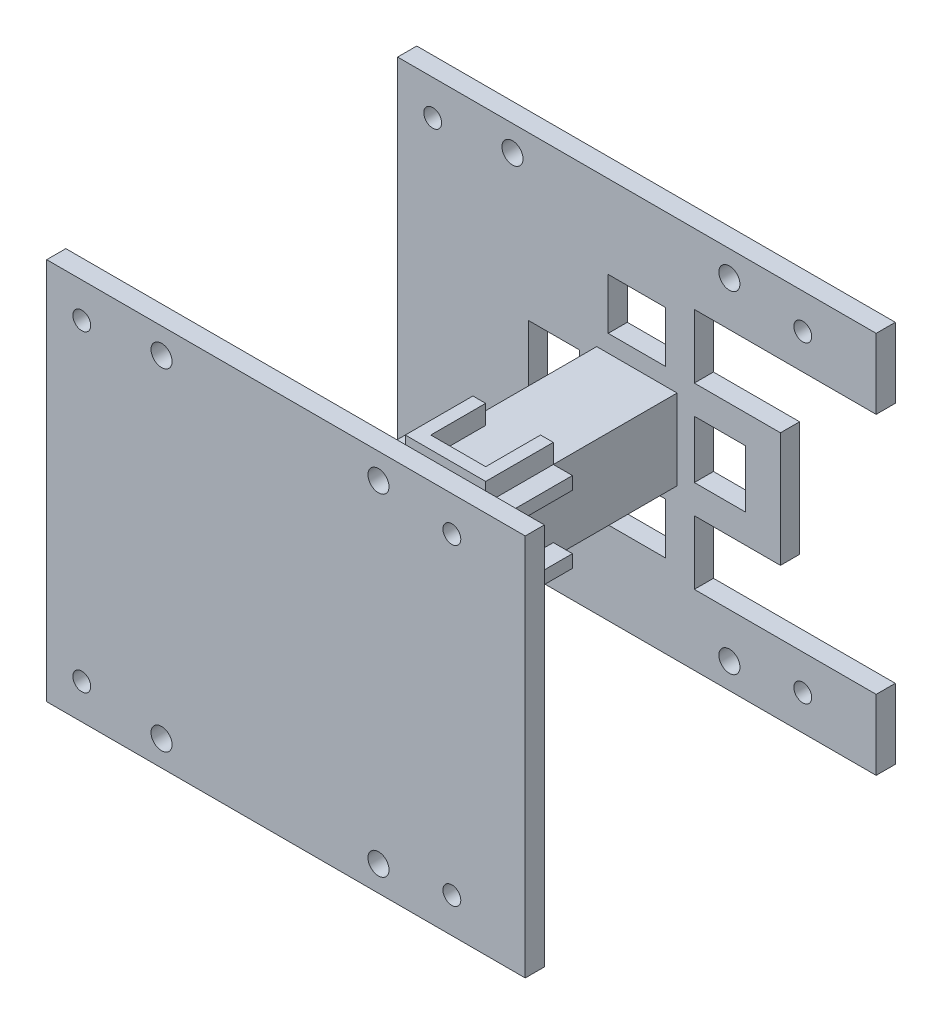
from build123d import *

# Parameters (mm, degrees)
SKETCH_4_R          = 1.4
SKETCH_4_R_2        = 1.65
EXTRUDE_1_DEPTH     = 3
SKETCH_5_W          = 12.6
SKETCH_5_H          = 12.6
EXTRUDE_2_DEPTH     = 30
SKETCH_6_W          = 9
SKETCH_6_H          = 8
SKETCH_6_W_2        = 8
SKETCH_6_H_2        = 9
CUT_EXTRUDE_2_DEPTH = 71.809603868
EXTRUDE_3_DEPTH     = 3
EXTRUDE_4_DEPTH     = 3
EXTRUDE_5_DEPTH     = 3
EXTRUDE_6_DEPTH     = 3
SKETCH_13_W         = 12.6
SKETCH_13_H         = 12.6
EXTRUDE_7_DEPTH     = 22
SKETCH_14_R         = 1.4
SKETCH_14_R_2       = 1.65
EXTRUDE_8_DEPTH     = 3
SKETCH_15_W         = 13.5
SKETCH_15_H         = 10
CUT_EXTRUDE_3_DEPTH = 84.366660003


with BuildPart() as part:
    # 草图4 → 凸台-拉伸1 (new body)
    with BuildSketch(Plane.XY):
        Polygon((-39, 30), (20, 30), (20, 19), (5, 19), (5, -19), (20, -19), (20, -30), (-39, -30), (-55, -30), (-55, 30), align=None)
        with Locations((-49.5, 24.5)):
            Circle(SKETCH_4_R, mode=Mode.SUBTRACT)
        with Locations((8.5, 24.5)):
            Circle(SKETCH_4_R, mode=Mode.SUBTRACT)
        with Locations((-3, 26)):
            Circle(SKETCH_4_R_2, mode=Mode.SUBTRACT)
        with Locations((-37, 26)):
            Circle(SKETCH_4_R_2, mode=Mode.SUBTRACT)
        with Locations(Location((-37, -26, 0), (0, 0, 180))):
            Circle(SKETCH_4_R_2, mode=Mode.SUBTRACT)
        with Locations(Location((-3, -26, 0), (0, 0, 180))):
            Circle(SKETCH_4_R_2, mode=Mode.SUBTRACT)
        with Locations(Location((8.5, -24.5, 0), (0, 0, 180))):
            Circle(SKETCH_4_R, mode=Mode.SUBTRACT)
        with Locations(Location((-49.5, -24.5, 0), (0, 0, 180))):
            Circle(SKETCH_4_R, mode=Mode.SUBTRACT)
    extrude(amount=EXTRUDE_1_DEPTH)

    # 草图5 → 凸台-拉伸2 (add)
    with BuildSketch(Plane.XY.offset(3)):
        with Locations((-17.5, 0)):
            Rectangle(SKETCH_5_W, SKETCH_5_H)
    extrude(amount=EXTRUDE_2_DEPTH)

    # 草图6 → 切除-拉伸2 (cut, through all)
    with BuildSketch(Plane(origin=(0, 0, 0), x_dir=(-1, 0, 0), z_dir=(0, 0, -1))):
        with Locations((17.5, 13)):
            Rectangle(SKETCH_6_W, SKETCH_6_H)
        with Locations((30.5, 0)):
            Rectangle(SKETCH_6_W_2, SKETCH_6_H_2)
        with Locations((17.5, -13)):
            Rectangle(SKETCH_6_W, SKETCH_6_H)
        with Locations((4.5, 0)):
            Rectangle(SKETCH_6_W_2, SKETCH_6_H_2)
    extrude(amount=-CUT_EXTRUDE_2_DEPTH, mode=Mode.SUBTRACT)

    # 草图8 → 凸台-拉伸3 (add)
    with BuildSketch(Plane(origin=(-11.2, 0, 0), x_dir=(0, 0, -1), z_dir=(1, 0, 0))):
        Polygon((-31, 4.3), (-22.4, 4.3), (-22.4, 6.3), (-33, 6.3), (-33, -6.3), (-22.4, -6.3), (-22.4, -4.3), (-31, -4.3), align=None)
    extrude(amount=EXTRUDE_3_DEPTH)

    # 草图10 → 凸台-拉伸4 (add)
    with BuildSketch(Plane.ZY.offset(23.8)):
        Polygon((22.4, 6.3), (22.4, 4.3), (31, 4.3), (31, -4.3), (22.4, -4.3), (22.4, -6.3), (33, -6.3), (33, 6.3), align=None)
    extrude(amount=EXTRUDE_4_DEPTH)

    # 草图11 → 凸台-拉伸5 (add)
    with BuildSketch(Plane.XZ.offset(6.3)):
        Polygon((-23.8, 22.4), (-23.8, 33), (-11.2, 33), (-11.2, 22.4), (-13.2, 22.4), (-13.2, 31), (-21.8, 31), (-21.8, 22.4), align=None)
    extrude(amount=EXTRUDE_5_DEPTH)

    # 草图12 → 凸台-拉伸6 (add)
    with BuildSketch(Plane(origin=(0, 6.3, 0), x_dir=(1, 0, 0), z_dir=(0, 1, 0))):
        Polygon((-23.8, -22.4), (-23.8, -33), (-11.2, -33), (-11.2, -22.4), (-13.2, -22.4), (-13.2, -31), (-21.8, -31), (-21.8, -22.4), align=None)
    extrude(amount=EXTRUDE_6_DEPTH)

    # 草图13 → 凸台-拉伸7 (add)
    with BuildSketch(Plane.XY.offset(33)):
        with Locations((-17.5, 0)):
            Rectangle(SKETCH_13_W, SKETCH_13_H)
    extrude(amount=EXTRUDE_7_DEPTH)

    # 草图14 → 凸台-拉伸8 (add)
    with BuildSketch(Plane.XY.offset(55)):
        Polygon((-39, 30), (20, 30), (20, -30), (-39, -30), (-55, -30), (-55, 30), align=None)
        with Locations((-49.5, 24.5)):
            Circle(SKETCH_14_R, mode=Mode.SUBTRACT)
        with Locations((8.5, 24.5)):
            Circle(SKETCH_14_R, mode=Mode.SUBTRACT)
        with Locations((-3, 26)):
            Circle(SKETCH_14_R_2, mode=Mode.SUBTRACT)
        with Locations((-37, 26)):
            Circle(SKETCH_14_R_2, mode=Mode.SUBTRACT)
        with Locations(Location((-37, -26, 0), (0, 0, 180))):
            Circle(SKETCH_14_R_2, mode=Mode.SUBTRACT)
        with Locations(Location((-3, -26, 0), (0, 0, 180))):
            Circle(SKETCH_14_R_2, mode=Mode.SUBTRACT)
        with Locations(Location((8.5, -24.5, 0), (0, 0, 180))):
            Circle(SKETCH_14_R, mode=Mode.SUBTRACT)
        with Locations(Location((-49.5, -24.5, 0), (0, 0, 180))):
            Circle(SKETCH_14_R, mode=Mode.SUBTRACT)
    extrude(amount=EXTRUDE_8_DEPTH)

    # 草图15 → 切除-拉伸3 (cut, through all)
    with BuildSketch(Plane.XY.offset(3)):
        with Locations((-1.75, 14)):
            Rectangle(SKETCH_15_W, SKETCH_15_H)
        with Locations((-1.75, -14)):
            Rectangle(SKETCH_15_W, SKETCH_15_H)
    extrude(amount=-CUT_EXTRUDE_3_DEPTH, mode=Mode.SUBTRACT)


solid = part.part
